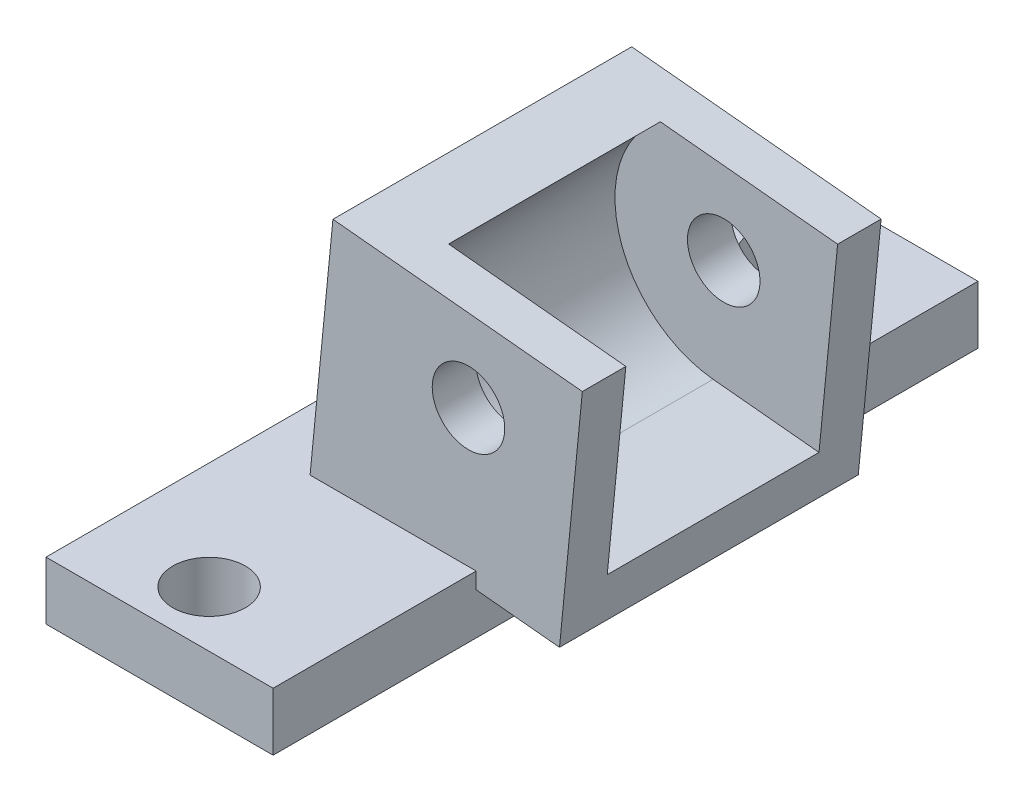
from build123d import *

# Parameters (mm, degrees)
BOSS_EXTRUDE1_DEPTH = 22.352
BOSS_EXTRUDE2_START = -3.81
SKETCH2_R           = 3.175
BOSS_EXTRUDE2_DEPTH = 3.81
BOSS_EXTRUDE4_START = 3.81
SKETCH3_R           = 3.175
BOSS_EXTRUDE4_DEPTH = 3.81
SKETCH4_W           = 19.88678917
SKETCH4_H           = 61.722
BOSS_EXTRUDE5_DEPTH = 5.08
SKETCH6_R           = 3.175
SKETCH6_R_2         = 3.112599105
CUT_EXTRUDE2_DEPTH  = 5.08


with BuildPart() as part:
    # Sketch1 → Boss-Extrude1 (new body)
    with BuildSketch(Plane.XY):
        with BuildLine():
            Line((-476.384421201, 136.819327006), (-476.01254536, 140.611135065))
            Line((-476.01254536, 140.611135065), (-485.284620904, 141.520479852))
            ThreePointArc((-485.284620904, 141.520479852), (-488.563156596, 142.455032775), (-491.302607825, 144.484217934))
            ThreePointArc((-491.302607825, 144.484217934), (-493.83445145, 151.929689602), (-489.904354663, 158.741416237))
            Line((-489.904354663, 158.741416237), (-496.224034762, 159.361209305))
            Line((-496.224034762, 159.361209305), (-498.224726786, 138.961281946))
            Line((-498.224726786, 138.961281946), (-476.384421201, 136.819327006))
        make_face()
    extrude(amount=-BOSS_EXTRUDE1_DEPTH)

    # Sketch2 → Boss-Extrude2 (add)
    with BuildSketch(Plane(origin=(0, 0, -22.352), x_dir=(-1, 0, 0), z_dir=(0, 0, -1)).offset(BOSS_EXTRUDE2_START)):
        with BuildLine():
            Line((474.383729176, 157.219254365), (489.904354663, 158.741416237))
            ThreePointArc((489.904354663, 158.741416237), (493.55465351, 148.532058286), (485.284620904, 141.520479852))
            Line((485.284620904, 141.520479852), (476.01254536, 140.611135065))
            Line((476.01254536, 140.611135065), (474.383729176, 157.219254365))
        make_face()
        with Locations((484.354931302, 151)):
            Circle(SKETCH2_R, mode=Mode.SUBTRACT)
    extrude(amount=BOSS_EXTRUDE2_DEPTH)

    # Sketch3 → Boss-Extrude4 (add)
    # profile 1 of 2: a face of its own
    with BuildSketch(Plane.XY.offset(BOSS_EXTRUDE4_START)):
        with BuildLine():
            Line((-474.383729176, 157.219254365), (-489.904354663, 158.741416237))
            ThreePointArc((-489.904354663, 158.741416237), (-493.55465351, 148.532058286), (-485.284620904, 141.520479852))
            Line((-485.284620904, 141.520479852), (-476.01254536, 140.611135065))
            Line((-476.01254536, 140.611135065), (-474.383729176, 157.219254365))
        make_face()
        with Locations(Location((-484.354931302, 151, 0), (0, 0, 180))):
            Circle(SKETCH3_R, mode=Mode.SUBTRACT)
    # profile 2 of 2: a face of its own
    with BuildSketch(Plane.XY.offset(BOSS_EXTRUDE4_START)):
        with BuildLine():
            Line((-476.01254536, 140.611135065), (-485.284620904, 141.520479852))
            ThreePointArc((-485.284620904, 141.520479852), (-493.55465351, 148.532058286), (-489.904354663, 158.741416237))
            Line((-489.904354663, 158.741416237), (-496.224034762, 159.361209305))
            Line((-496.224034762, 159.361209305), (-498.224726786, 138.961281946))
            Line((-498.224726786, 138.961281946), (-476.384421201, 136.819327006))
            Line((-476.384421201, 136.819327006), (-476.01254536, 140.611135065))
        make_face()
    extrude(amount=-BOSS_EXTRUDE4_DEPTH)

    # Sketch4 → Boss-Extrude5 (add)
    with BuildSketch(Plane(origin=(0, 138.961281946, 0), x_dir=(1, 0, 0), z_dir=(0, 1, 0))):
        with Locations((-493.624258186, 9.271)):
            Rectangle(SKETCH4_W, SKETCH4_H)
    extrude(amount=-BOSS_EXTRUDE5_DEPTH)

    # Sketch6 → Cut-Extrude2 (cut)
    with BuildSketch(Plane(origin=(0, 138.961281946, 0), x_dir=(1, 0, 0), z_dir=(0, 1, 0))):
        with Locations(Location((-494.169652771, -16.705193035, 0), (0, 0, 270))):
            Circle(SKETCH6_R)
        with Locations(Location((-494.169652771, 33.836204424, 0), (0, 0, 270))):
            Circle(SKETCH6_R_2)
    extrude(amount=-CUT_EXTRUDE2_DEPTH, mode=Mode.SUBTRACT)


solid = part.part
